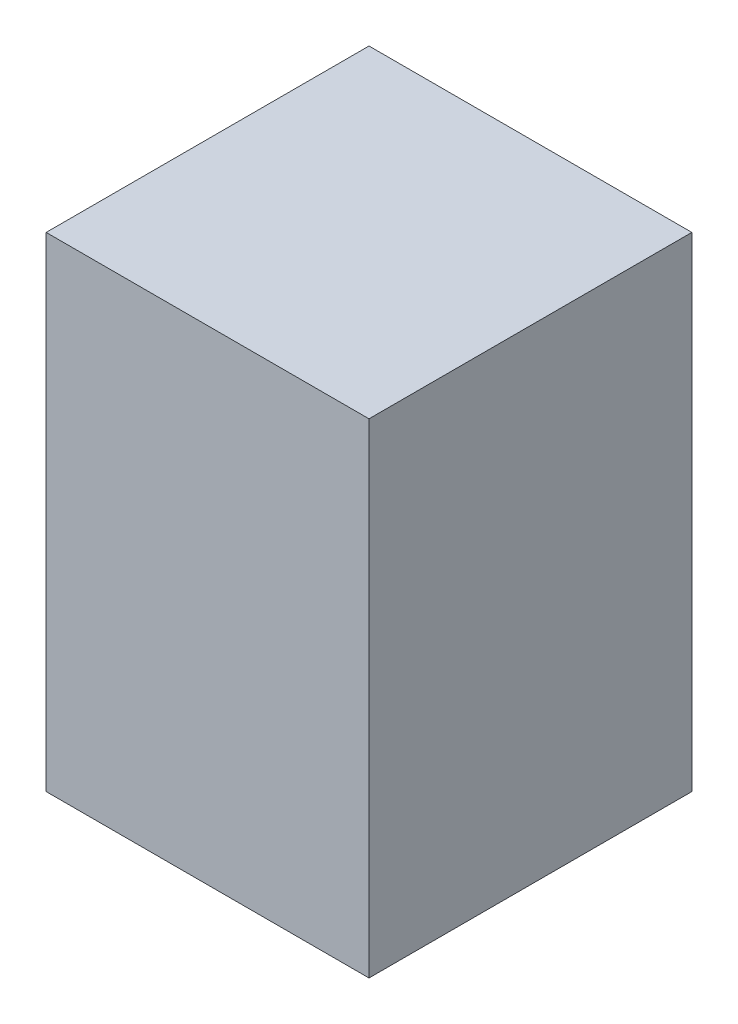
from build123d import *

# Parameters (mm, degrees)
STORE_AYAK_4_1_START = -680
SKETCH1_W            = 80
SKETCH1_H            = 120
STORE_AYAK_4_1_DEPTH = 80


with BuildPart() as part:
    # Sketch1 → STORE_ayak_4_1 (new body)
    with BuildSketch(Plane.XY.offset(STORE_AYAK_4_1_START)):
        with Locations((1300, 60)):
            Rectangle(SKETCH1_W, SKETCH1_H)
    extrude(amount=-STORE_AYAK_4_1_DEPTH)


solid = part.part
